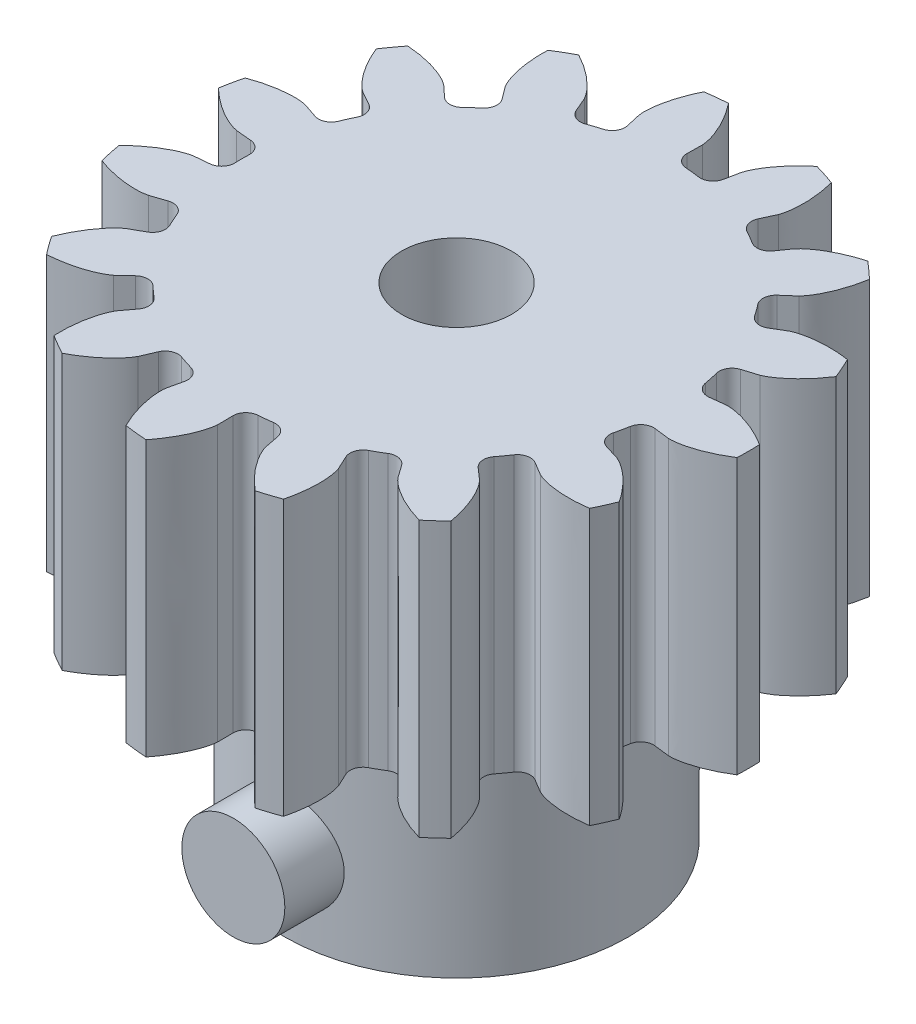
from build123d import *

# Parameters (mm, degrees)
BOSS_EXTRUDE1_DEPTH      = 4
BOSS_EXTRUDE1_DEPTH_BACK = 4
SKETCH2_R                = 5
BOSS_EXTRUDE2_DEPTH      = 6
CUT_EXTRUDE1_REACH       = 20.444
SKETCH3_R                = 1.6
BOSS_EXTRUDE3_START      = 4.5
SKETCH6_R                = 1.5
BOSS_EXTRUDE3_DEPTH      = 2


with BuildPart() as part:
    # Sketch1 → Boss-Extrude1 (new, two sides: drawn at the far end of the back side and taken through both)
    with BuildSketch(Plane(origin=(0, 0, 8), x_dir=(1, 0, 0), z_dir=(0, -1, 0)).offset(-BOSS_EXTRUDE1_DEPTH_BACK)):
        with BuildLine():
            Line((6.567109026, -8.789353559), (7.013376588, -8.842263002))
            add(Edge.make_bspline(
                [(7.013376588, -8.842263002), (7.13650623, -8.846158953), (7.26014648, -8.826739675), (7.380662944, -8.801207947), (7.5493573, -8.765469607), (7.714728417, -8.712040157), (7.874555163, -8.647306658), (8.089914841, -8.560081048), (8.297207677, -8.451055972), (8.493631405, -8.3269358)],
                knots=[0, 0, 0, 0, 0.000369574, 0.000369574, 0.000369574, 0.000886684, 0.000886684, 0.000886684, 0.001584079, 0.001584079, 0.001584079, 0.001584079], degree=3))
            ThreePointArc((8.493631405, -8.3269358), (8.499921204, -8), (8.493631405, -7.6730642))
            add(Edge.make_bspline(
                [(8.493631405, -7.6730642), (8.306513905, -7.554824634), (8.109584884, -7.450333654), (7.905230151, -7.36528839), (7.765919668, -7.307312258), (7.622450842, -7.257991784), (7.476161462, -7.221004491), (7.40107364, -7.20201955), (7.325048593, -7.186231596), (7.248436403, -7.174865806), (7.170725894, -7.163337076), (7.091898317, -7.155252488), (7.013376588, -7.157736998)],
                knots=[0, 0, 0, 0, 0.000664035, 0.000664035, 0.000664035, 0.001116085, 0.001116085, 0.001116085, 0.001347695, 0.001347695, 0.001347695, 0.001582954, 0.001582954, 0.001582954, 0.001582954], degree=3))
            Line((7.013376588, -7.157736998), (6.567109026, -7.210646441))
            ThreePointArc((6.567109026, -7.210646441), (6.299401561, -7.139849418), (6.153266145, -6.90463899))
            ThreePointArc((6.153266145, -6.90463899), (6.113422505, -6.700551932), (6.066811797, -6.49790326))
            ThreePointArc((6.066811797, -6.49790326), (6.104644442, -6.223589213), (6.320411637, -6.050026478))
            Line((6.320411637, -6.050026478), (6.749617551, -5.91684829))
            add(Edge.make_bspline(
                [(6.749617551, -5.91684829), (6.863686702, -5.870326081), (6.968739159, -5.802296667), (7.068451738, -5.729953811), (7.208025608, -5.628691037), (7.337367925, -5.512618312), (7.457047437, -5.388473925), (7.618310441, -5.221194693), (7.763337377, -5.037281737), (7.892295159, -4.84399959)],
                knots=[0, 0, 0, 0, 0.000369574, 0.000369574, 0.000369574, 0.000886684, 0.000886684, 0.000886684, 0.001584079, 0.001584079, 0.001584079, 0.001584079], degree=3))
            ThreePointArc((7.892295159, -4.84399959), (7.765064406, -4.542770583), (7.626341619, -4.246658159))
            add(Edge.make_bspline(
                [(7.626341619, -4.246658159), (7.407308913, -4.214748485), (7.18490499, -4.199389474), (6.963626627, -4.204815317), (6.81277915, -4.208514164), (6.661653412, -4.221811698), (6.512967325, -4.247523375), (6.436649316, -4.260720737), (6.360775441, -4.277219896), (6.286163839, -4.297997716), (6.2104826, -4.319073408), (6.135181726, -4.343749833), (6.064459099, -4.37795721)],
                knots=[0, 0, 0, 0, 0.000664035, 0.000664035, 0.000664035, 0.001116085, 0.001116085, 0.001116085, 0.001347695, 0.001347695, 0.001347695, 0.001582954, 0.001582954, 0.001582954, 0.001582954], degree=3))
            Line((6.064459099, -4.37795721), (5.678293604, -4.607805762))
            ThreePointArc((5.678293604, -4.607805762), (5.404934922, -4.652015898), (5.175764877, -4.496579109))
            ThreePointArc((5.175764877, -4.496579109), (5.056356215, -4.326342173), (4.931350574, -4.160171681))
            ThreePointArc((4.931350574, -4.160171681), (4.854338841, -3.894185407), (4.980857657, -3.647867535))
            Line((4.980857657, -3.647867535), (5.318788321, -3.351629433))
            add(Edge.make_bspline(
                [(5.318788321, -3.351629433), (5.404073389, -3.262733177), (5.472373528, -3.157856531), (5.534041011, -3.051211284), (5.620360805, -2.90193333), (5.691309861, -2.743287359), (5.750148465, -2.581197774), (5.829430956, -2.362789019), (5.887115516, -2.135788405), (5.926309381, -1.906764522)],
                knots=[0, 0, 0, 0, 0.000369574, 0.000369574, 0.000369574, 0.000886684, 0.000886684, 0.000886684, 0.001584079, 0.001584079, 0.001584079, 0.001584079], degree=3))
            ThreePointArc((5.926309381, -1.906764522), (5.687557429, -1.68332754), (5.440388084, -1.469239021))
            add(Edge.make_bspline(
                [(5.440388084, -1.469239021), (5.227312916, -1.529176712), (5.01788975, -1.605605381), (4.817948796, -1.700564154), (4.681647225, -1.765298415), (4.548995588, -1.838914692), (4.42362197, -1.922879558), (4.35926985, -1.965977279), (4.296666428, -2.011910696), (4.236956439, -2.061239451), (4.176390443, -2.111275387), (4.117636479, -2.164446048), (4.066941537, -2.224461526)],
                knots=[0, 0, 0, 0, 0.000664035, 0.000664035, 0.000664035, 0.001116085, 0.001116085, 0.001116085, 0.001347695, 0.001347695, 0.001347695, 0.001582954, 0.001582954, 0.001582954, 0.001582954], degree=3))
            Line((4.066941537, -2.224461526), (3.807649632, -2.591506283))
            ThreePointArc((3.807649632, -2.591506283), (3.575905932, -2.743079246), (3.30332684, -2.694292527))
            ThreePointArc((3.30332684, -2.694292527), (3.125, -2.587341226), (2.943214036, -2.486381303))
            ThreePointArc((2.943214036, -2.486381303), (2.764673953, -2.274714244), (2.780068139, -1.998231832))
            Line((2.780068139, -1.998231832), (2.96829227, -1.590156076))
            add(Edge.make_bspline(
                [(2.96829227, -1.590156076), (3.010046692, -1.474256743), (3.029784799, -1.35066699), (3.042744319, -1.228159284), (3.06088456, -1.056677664), (3.061172619, -0.882889777), (3.048996584, -0.710881757), (3.0325899, -0.479108337), (2.992957899, -0.248270532), (2.935610871, -0.023105224)],
                knots=[0, 0, 0, 0, 0.000369574, 0.000369574, 0.000369574, 0.000886684, 0.000886684, 0.000886684, 0.001584079, 0.001584079, 0.001584079, 0.001584079], degree=3))
            ThreePointArc((2.935610871, -0.023105224), (2.626620103, 0.083905449), (2.313742025, 0.178952213))
            add(Edge.make_bspline(
                [(2.313742025, 0.178952213), (2.143467028, 0.03753093), (1.983235787, -0.117470209), (1.839203848, -0.285542678), (1.741015964, -0.400119211), (1.6497751, -0.521325308), (1.569392189, -0.649025074), (1.528133024, -0.714571167), (1.489624757, -0.781996537), (1.455140779, -0.851346838), (1.420162438, -0.92169135), (1.388114476, -0.994162555), (1.366212837, -1.069608913)],
                knots=[0, 0, 0, 0, 0.000664035, 0.000664035, 0.000664035, 0.001116085, 0.001116085, 0.001116085, 0.001347695, 0.001347695, 0.001347695, 0.001582954, 0.001582954, 0.001582954, 0.001582954], degree=3))
            Line((1.366212837, -1.069608913), (1.278628447, -1.510384503))
            ThreePointArc((1.278628447, -1.510384503), (1.128570321, -1.743111949), (0.859713583, -1.809410969))
            ThreePointArc((0.859713583, -1.809410969), (0.653302895, -1.784238154), (0.446169054, -1.765945687))
            ThreePointArc((0.446169054, -1.765945687), (0.196971823, -1.645197001), (0.098579583, -1.38635637))
            Line((0.098579583, -1.38635637), (0.10455152, -0.937002965))
            add(Edge.make_bspline(
                [(0.10455152, -0.937002965), (0.095555577, -0.814140602), (0.063318754, -0.693207534), (0.025329491, -0.576020064), (-0.027846432, -0.411985508), (-0.09826918, -0.253105209), (-0.179354506, -0.100920504), (-0.2886135, 0.104141852), (-0.418709328, 0.298902893), (-0.562681427, 0.4812765)],
                knots=[0, 0, 0, 0, 0.000369574, 0.000369574, 0.000369574, 0.000886684, 0.000886684, 0.000886684, 0.001584079, 0.001584079, 0.001584079, 0.001584079], degree=3))
            ThreePointArc((-0.562681427, 0.4812765), (-0.888483701, 0.453357746), (-1.21297105, 0.412928307))
            add(Edge.make_bspline(
                [(-1.21297105, 0.412928307), (-1.311003782, 0.214476455), (-1.394337662, 0.007703951), (-1.457556153, -0.204420956), (-1.500652775, -0.349028438), (-1.53470649, -0.49686672), (-1.556199759, -0.646220937), (-1.567231884, -0.722881886), (-1.574986569, -0.80014075), (-1.57828194, -0.8775213), (-1.581624555, -0.956011182), (-1.58142513, -1.035252003), (-1.570746474, -1.11308388)],
                knots=[0, 0, 0, 0, 0.000664035, 0.000664035, 0.000664035, 0.001116085, 0.001116085, 0.001116085, 0.001347695, 0.001347695, 0.001347695, 0.001582954, 0.001582954, 0.001582954, 0.001582954], degree=3))
            Line((-1.570746474, -1.11308388), (-1.471479212, -1.551376199))
            ThreePointArc((-1.471479212, -1.551376199), (-1.513905352, -1.825017438), (-1.732551962, -1.994938493))
            ThreePointArc((-1.732551962, -1.994938493), (-1.931356215, -2.055896773), (-2.128022611, -2.123434697))
            ThreePointArc((-2.128022611, -2.123434697), (-2.404788525, -2.114482928), (-2.599954278, -1.918039975))
            Line((-2.599954278, -1.918039975), (-2.777267138, -1.505106207))
            add(Edge.make_bspline(
                [(-2.777267138, -1.505106207), (-2.835457966, -1.396524834), (-2.914095679, -1.299158875), (-2.996465036, -1.20755442), (-3.111762524, -1.079329993), (-3.240719344, -0.962829129), (-3.376693572, -0.856781856), (-3.559913004, -0.713887709), (-3.757977909, -0.588879385), (-3.963680994, -0.480831533)],
                knots=[0, 0, 0, 0, 0.000369574, 0.000369574, 0.000369574, 0.000886684, 0.000886684, 0.000886684, 0.001584079, 0.001584079, 0.001584079, 0.001584079], degree=3))
            ThreePointArc((-3.963680994, -0.480831533), (-4.249960602, -0.638852307), (-4.529950411, -0.807767333))
            add(Edge.make_bspline(
                [(-4.529950411, -0.807767333), (-4.538790128, -1.028935625), (-4.530817461, -1.251726649), (-4.502291454, -1.471225671), (-4.482845015, -1.620860155), (-4.453823386, -1.76976804), (-4.412710631, -1.914952006), (-4.391608162, -1.989472438), (-4.367268408, -2.063206036), (-4.338805374, -2.135237034), (-4.309934294, -2.208300674), (-4.277521964, -2.280609652), (-4.236109451, -2.347369209)],
                knots=[0, 0, 0, 0, 0.000664035, 0.000664035, 0.000664035, 0.001116085, 0.001116085, 0.001116085, 0.001347695, 0.001347695, 0.001347695, 0.001582954, 0.001582954, 0.001582954, 0.001582954], degree=3))
            Line((-4.236109451, -2.347369209), (-3.967154748, -2.707393534))
            ThreePointArc((-3.967154748, -2.707393534), (-3.894613036, -2.974633511), (-4.025243534, -3.218795707))
            ThreePointArc((-4.025243534, -3.218795707), (-4.18206629, -3.355344841), (-4.334259835, -3.497035234))
            ThreePointArc((-4.334259835, -3.497035234), (-4.59073909, -3.601428225), (-4.848932425, -3.501349721))
            Line((-4.848932425, -3.501349721), (-5.178871077, -3.19623559))
            add(Edge.make_bspline(
                [(-5.178871077, -3.19623559), (-5.276195067, -3.120709912), (-5.387636496, -3.063746522), (-5.500143536, -3.013564324), (-5.657626606, -2.943321194), (-5.822819693, -2.889343824), (-5.990171643, -2.84777052), (-6.215671209, -2.791752278), (-6.447457969, -2.758111746), (-6.679324109, -2.743072103)],
                knots=[0, 0, 0, 0, 0.000369574, 0.000369574, 0.000369574, 0.000886684, 0.000886684, 0.000886684, 0.001584079, 0.001584079, 0.001584079, 0.001584079], degree=3))
            ThreePointArc((-6.679324109, -2.743072103), (-6.876580705, -3.003871671), (-7.063660193, -3.27206534))
            add(Edge.make_bspline(
                [(-7.063660193, -3.27206534), (-6.981778428, -3.477708065), (-6.883877761, -3.677995018), (-6.768539661, -3.86691478), (-6.689912627, -3.995703104), (-6.602833756, -4.119933065), (-6.506223747, -4.235843155), (-6.456635492, -4.295337809), (-6.404409863, -4.352796933), (-6.349109942, -4.407023566), (-6.293017238, -4.462027595), (-6.233996391, -4.514901852), (-6.169010619, -4.559045755)],
                knots=[0, 0, 0, 0, 0.000664035, 0.000664035, 0.000664035, 0.001116085, 0.001116085, 0.001116085, 0.001347695, 0.001347695, 0.001347695, 0.001582954, 0.001582954, 0.001582954, 0.001582954], degree=3))
            Line((-6.169010619, -4.559045755), (-5.776873187, -4.778550608))
            ThreePointArc((-5.776873187, -4.778550608), (-5.601906744, -4.993181103), (-5.62193393, -5.269366579))
            ThreePointArc((-5.62193393, -5.269366579), (-5.70965911, -5.457895981), (-5.791064157, -5.649239287))
            ThreePointArc((-5.791064157, -5.649239287), (-5.982909161, -5.848926542), (-6.259486104, -5.862516969))
            Line((-6.259486104, -5.862516969), (-6.685001158, -5.71797948))
            add(Edge.make_bspline(
                [(-6.685001158, -5.71797948), (-6.804630108, -5.688568573), (-6.929606017, -5.68185724), (-7.052797252, -5.681774257), (-7.225235649, -5.681658099), (-7.398101619, -5.6995374), (-7.567894618, -5.729626467), (-7.796683394, -5.770170193), (-8.022113973, -5.833714206), (-8.240051405, -5.914283265)],
                knots=[0, 0, 0, 0, 0.000369574, 0.000369574, 0.000369574, 0.000886684, 0.000886684, 0.000886684, 0.001584079, 0.001584079, 0.001584079, 0.001584079], degree=3))
            ThreePointArc((-8.240051405, -5.914283265), (-8.314177532, -6.232767011), (-8.375998955, -6.553866202))
            add(Edge.make_bspline(
                [(-8.375998955, -6.553866202), (-8.217553809, -6.708425865), (-8.046653057, -6.851577312), (-7.86444587, -6.977251872), (-7.74023357, -7.062925364), (-7.610154186, -7.140996913), (-7.47475167, -7.207591218), (-7.405251888, -7.241772929), (-7.334170672, -7.273022374), (-7.261595722, -7.300068364), (-7.187980332, -7.327502086), (-7.112556207, -7.351799182), (-7.035233808, -7.36569455)],
                knots=[0, 0, 0, 0, 0.000664035, 0.000664035, 0.000664035, 0.001116085, 0.001116085, 0.001116085, 0.001347695, 0.001347695, 0.001347695, 0.001582954, 0.001582954, 0.001582954, 0.001582954], degree=3))
            Line((-7.035233808, -7.36569455), (-6.587717771, -7.406725549))
            ThreePointArc((-6.587717771, -7.406725549), (-6.340579885, -7.531634999), (-6.246540877, -7.792088776))
            ThreePointArc((-6.246540877, -7.792088776), (-6.25, -8), (-6.246540877, -8.207911224))
            ThreePointArc((-6.246540877, -8.207911224), (-6.340579885, -8.468365001), (-6.587717771, -8.593274451))
            Line((-6.587717771, -8.593274451), (-7.035233808, -8.63430545))
            add(Edge.make_bspline(
                [(-7.035233808, -8.63430545), (-7.156482786, -8.656094727), (-7.273383704, -8.700795901), (-7.38595825, -8.750826481), (-7.54353581, -8.820857381), (-7.694184564, -8.907501859), (-7.837059861, -9.004050624), (-8.029578189, -9.134145939), (-8.209673592, -9.283887161), (-8.375998955, -9.446133798)],
                knots=[0, 0, 0, 0, 0.000369574, 0.000369574, 0.000369574, 0.000886684, 0.000886684, 0.000886684, 0.001584079, 0.001584079, 0.001584079, 0.001584079], degree=3))
            ThreePointArc((-8.375998955, -9.446133798), (-8.314177532, -9.767232989), (-8.240051405, -10.085716735))
            add(Edge.make_bspline(
                [(-8.240051405, -10.085716735), (-8.032439483, -10.162468567), (-7.818088938, -10.223732323), (-7.600517942, -10.264431406), (-7.452197811, -10.292176342), (-7.30160982, -10.310590199), (-7.150827123, -10.316353959), (-7.073432959, -10.319312397), (-6.995786742, -10.31894885), (-6.918485631, -10.3141377), (-6.840076326, -10.309257577), (-6.76129044, -10.300776323), (-6.685001158, -10.28202052)],
                knots=[0, 0, 0, 0, 0.000664035, 0.000664035, 0.000664035, 0.001116085, 0.001116085, 0.001116085, 0.001347695, 0.001347695, 0.001347695, 0.001582954, 0.001582954, 0.001582954, 0.001582954], degree=3))
            Line((-6.685001158, -10.28202052), (-6.259486104, -10.137483031))
            ThreePointArc((-6.259486104, -10.137483031), (-5.982909161, -10.151073458), (-5.791064157, -10.350760713))
            ThreePointArc((-5.791064157, -10.350760713), (-5.70965911, -10.542104019), (-5.62193393, -10.730633421))
            ThreePointArc((-5.62193393, -10.730633421), (-5.601906744, -11.006818897), (-5.776873187, -11.221449392))
            Line((-5.776873187, -11.221449392), (-6.169010619, -11.440954245))
            add(Edge.make_bspline(
                [(-6.169010619, -11.440954245), (-6.270914575, -11.510176142), (-6.359527273, -11.598560583), (-6.442019967, -11.690053985), (-6.557490098, -11.818122964), (-6.659873099, -11.958551002), (-6.751126257, -12.104865306), (-6.87408597, -12.302017549), (-6.977706065, -12.512064361), (-7.063660193, -12.72793466)],
                knots=[0, 0, 0, 0, 0.000369574, 0.000369574, 0.000369574, 0.000886684, 0.000886684, 0.000886684, 0.001584079, 0.001584079, 0.001584079, 0.001584079], degree=3))
            ThreePointArc((-7.063660193, -12.72793466), (-6.876580705, -12.996128329), (-6.679324109, -13.256927897))
            add(Edge.make_bspline(
                [(-6.679324109, -13.256927897), (-6.458443398, -13.242600808), (-6.237706217, -13.211383812), (-6.022391413, -13.160070178), (-5.875609349, -13.125089206), (-5.730550784, -13.080661448), (-5.590459603, -13.024598056), (-5.518553211, -12.995821682), (-5.44776773, -12.963908004), (-5.379106522, -12.928071605), (-5.309460983, -12.891721453), (-5.240936131, -12.851928335), (-5.178871077, -12.80376441)],
                knots=[0, 0, 0, 0, 0.000664035, 0.000664035, 0.000664035, 0.001116085, 0.001116085, 0.001116085, 0.001347695, 0.001347695, 0.001347695, 0.001582954, 0.001582954, 0.001582954, 0.001582954], degree=3))
            Line((-5.178871077, -12.80376441), (-4.848932425, -12.498650279))
            ThreePointArc((-4.848932425, -12.498650279), (-4.59073909, -12.398571775), (-4.334259835, -12.502964766))
            ThreePointArc((-4.334259835, -12.502964766), (-4.18206629, -12.644655159), (-4.025243534, -12.781204293))
            ThreePointArc((-4.025243534, -12.781204293), (-3.894613036, -13.025366489), (-3.967154748, -13.292606466))
            Line((-3.967154748, -13.292606466), (-4.236109451, -13.652630791))
            add(Edge.make_bspline(
                [(-4.236109451, -13.652630791), (-4.301048265, -13.757316213), (-4.346050801, -13.87410145), (-4.384197908, -13.991237633), (-4.437594776, -14.1552004), (-4.474009073, -14.325130714), (-4.497861591, -14.495911486), (-4.530001837, -14.726031242), (-4.539229769, -14.960064643), (-4.529950411, -15.192232667)],
                knots=[0, 0, 0, 0, 0.000369574, 0.000369574, 0.000369574, 0.000886684, 0.000886684, 0.000886684, 0.001584079, 0.001584079, 0.001584079, 0.001584079], degree=3))
            ThreePointArc((-4.529950411, -15.192232667), (-4.249960602, -15.361147693), (-3.963680994, -15.519168467))
            add(Edge.make_bspline(
                [(-3.963680994, -15.519168467), (-3.767723776, -15.416239741), (-3.578767423, -15.297939697), (-3.402938697, -15.163485939), (-3.283074653, -15.071827587), (-3.168627456, -14.972240176), (-3.06345083, -14.864043503), (-3.009465478, -14.808508013), (-2.957780186, -14.750562368), (-2.909631028, -14.689897159), (-2.860791601, -14.62836225), (-2.814376353, -14.56413786), (-2.777267138, -14.494893793)],
                knots=[0, 0, 0, 0, 0.000664035, 0.000664035, 0.000664035, 0.001116085, 0.001116085, 0.001116085, 0.001347695, 0.001347695, 0.001347695, 0.001582954, 0.001582954, 0.001582954, 0.001582954], degree=3))
            Line((-2.777267138, -14.494893793), (-2.599954278, -14.081960025))
            ThreePointArc((-2.599954278, -14.081960025), (-2.404788525, -13.885517072), (-2.128022611, -13.876565303))
            ThreePointArc((-2.128022611, -13.876565303), (-1.931356215, -13.944103227), (-1.732551962, -14.005061507))
            ThreePointArc((-1.732551962, -14.005061507), (-1.513905352, -14.174982562), (-1.471479212, -14.448623801))
            Line((-1.471479212, -14.448623801), (-1.570746474, -14.88691612))
            add(Edge.make_bspline(
                [(-1.570746474, -14.88691612), (-1.587491636, -15.008964007), (-1.581102663, -15.13395681), (-1.568308202, -15.256481865), (-1.550399002, -15.427987769), (-1.514548232, -15.598037864), (-1.466875795, -15.763755556), (-1.402639232, -15.98705303), (-1.315879408, -16.204606518), (-1.21297105, -16.412928307)],
                knots=[0, 0, 0, 0, 0.000369574, 0.000369574, 0.000369574, 0.000886684, 0.000886684, 0.000886684, 0.001584079, 0.001584079, 0.001584079, 0.001584079], degree=3))
            ThreePointArc((-1.21297105, -16.412928307), (-0.888483701, -16.453357746), (-0.562681427, -16.4812765))
            add(Edge.make_bspline(
                [(-0.562681427, -16.4812765), (-0.425530485, -16.307543449), (-0.30102723, -16.122615508), (-0.195086966, -15.928269903), (-0.122866523, -15.795782733), (-0.058819656, -15.658255237), (-0.006743578, -15.51663347), (0.019986176, -15.443941454), (0.043634423, -15.369983172), (0.062946104, -15.294978719), (0.082534638, -15.218898997), (0.098814664, -15.141348316), (0.10455152, -15.062997035)],
                knots=[0, 0, 0, 0, 0.000664035, 0.000664035, 0.000664035, 0.001116085, 0.001116085, 0.001116085, 0.001347695, 0.001347695, 0.001347695, 0.001582954, 0.001582954, 0.001582954, 0.001582954], degree=3))
            Line((0.10455152, -15.062997035), (0.098579583, -14.61364363))
            ThreePointArc((0.098579583, -14.61364363), (0.196971823, -14.354802999), (0.446169054, -14.234054313))
            ThreePointArc((0.446169054, -14.234054313), (0.653302895, -14.215761846), (0.859713583, -14.190589031))
            ThreePointArc((0.859713583, -14.190589031), (1.128570321, -14.256888051), (1.278628447, -14.489615497))
            Line((1.278628447, -14.489615497), (1.366212837, -14.930391087))
            add(Edge.make_bspline(
                [(1.366212837, -14.930391087), (1.400556719, -15.048698251), (1.457232489, -15.160286229), (1.51875624, -15.267014459), (1.604874844, -15.416408571), (1.706791757, -15.557175242), (1.817746153, -15.689175759), (1.967252438, -15.867040788), (2.134998457, -16.030497389), (2.313742025, -16.178952213)],
                knots=[0, 0, 0, 0, 0.000369574, 0.000369574, 0.000369574, 0.000886684, 0.000886684, 0.000886684, 0.001584079, 0.001584079, 0.001584079, 0.001584079], degree=3))
            ThreePointArc((2.313742025, -16.178952213), (2.626620103, -16.083905449), (2.935610871, -15.976894776))
            add(Edge.make_bspline(
                [(2.935610871, -15.976894776), (2.990240893, -15.762397423), (3.028763307, -15.542817307), (3.046497074, -15.322183974), (3.058586345, -15.171776221), (3.061158598, -15.020088395), (3.051129699, -14.869529224), (3.045982039, -14.792249792), (3.037504244, -14.715066931), (3.024639283, -14.638692185), (3.011589889, -14.561222526), (2.994919729, -14.48375477), (2.96829227, -14.409843924)],
                knots=[0, 0, 0, 0, 0.000664035, 0.000664035, 0.000664035, 0.001116085, 0.001116085, 0.001116085, 0.001347695, 0.001347695, 0.001347695, 0.001582954, 0.001582954, 0.001582954, 0.001582954], degree=3))
            Line((2.96829227, -14.409843924), (2.780068139, -14.001768168))
            ThreePointArc((2.780068139, -14.001768168), (2.764673953, -13.725285756), (2.943214036, -13.513618697))
            ThreePointArc((2.943214036, -13.513618697), (3.125, -13.412658774), (3.30332684, -13.305707473))
            ThreePointArc((3.30332684, -13.305707473), (3.575905932, -13.256920754), (3.807649632, -13.408493717))
            Line((3.807649632, -13.408493717), (4.066941537, -13.775538474))
            add(Edge.make_bspline(
                [(4.066941537, -13.775538474), (4.146436093, -13.869648531), (4.243598905, -13.948537109), (4.343213931, -14.021014235), (4.48265125, -14.122464955), (4.633011946, -14.209608365), (4.788063278, -14.285067619), (4.99698829, -14.386745724), (5.216715693, -14.467842307), (5.440388084, -14.530760979)],
                knots=[0, 0, 0, 0, 0.000369574, 0.000369574, 0.000369574, 0.000886684, 0.000886684, 0.000886684, 0.001584079, 0.001584079, 0.001584079, 0.001584079], degree=3))
            ThreePointArc((5.440388084, -14.530760979), (5.687557429, -14.31667246), (5.926309381, -14.093235478))
            add(Edge.make_bspline(
                [(5.926309381, -14.093235478), (5.888972455, -13.875062364), (5.834853152, -13.658797468), (5.761314093, -13.450025917), (5.711181847, -13.307704447), (5.65183472, -13.168084493), (5.581434934, -13.034620967), (5.545299935, -12.966116436), (5.506161986, -12.899054613), (5.463344851, -12.834515462), (5.419913888, -12.769051074), (5.373175964, -12.705061122), (5.318788321, -12.648370567)],
                knots=[0, 0, 0, 0, 0.000664035, 0.000664035, 0.000664035, 0.001116085, 0.001116085, 0.001116085, 0.001347695, 0.001347695, 0.001347695, 0.001582954, 0.001582954, 0.001582954, 0.001582954], degree=3))
            Line((5.318788321, -12.648370567), (4.980857657, -12.352132465))
            ThreePointArc((4.980857657, -12.352132465), (4.854338841, -12.105814593), (4.931350574, -11.839828319))
            ThreePointArc((4.931350574, -11.839828319), (5.056356215, -11.673657827), (5.175764877, -11.503420891))
            ThreePointArc((5.175764877, -11.503420891), (5.404934922, -11.347984102), (5.678293604, -11.392194238))
            Line((5.678293604, -11.392194238), (6.064459099, -11.62204279))
            add(Edge.make_bspline(
                [(6.064459099, -11.62204279), (6.175358998, -11.675683256), (6.296208519, -11.708231882), (6.416690476, -11.73392595), (6.585336531, -11.769891528), (6.758142279, -11.788343789), (6.930480763, -11.79421419), (7.16269947, -11.802124303), (7.396415393, -11.786838532), (7.626341619, -11.753341841)],
                knots=[0, 0, 0, 0, 0.000369574, 0.000369574, 0.000369574, 0.000886684, 0.000886684, 0.000886684, 0.001584079, 0.001584079, 0.001584079, 0.001584079], degree=3))
            ThreePointArc((7.626341619, -11.753341841), (7.765064406, -11.457229417), (7.892295159, -11.15600041))
            add(Edge.make_bspline(
                [(7.892295159, -11.15600041), (7.76944718, -10.971875648), (7.632043879, -10.796320139), (7.479947566, -10.635508866), (7.376262124, -10.525882356), (7.265257274, -10.422471832), (7.146659362, -10.329181007), (7.085785095, -10.281296432), (7.022754299, -10.235951246), (6.957388463, -10.194407095), (6.891085538, -10.152267365), (6.822361261, -10.112819662), (6.749617551, -10.08315171)],
                knots=[0, 0, 0, 0, 0.000664035, 0.000664035, 0.000664035, 0.001116085, 0.001116085, 0.001116085, 0.001347695, 0.001347695, 0.001347695, 0.001582954, 0.001582954, 0.001582954, 0.001582954], degree=3))
            Line((6.749617551, -10.08315171), (6.320411637, -9.949973522))
            ThreePointArc((6.320411637, -9.949973522), (6.104644442, -9.776410787), (6.066811797, -9.50209674))
            ThreePointArc((6.066811797, -9.50209674), (6.113422505, -9.299448068), (6.153266145, -9.09536101))
            ThreePointArc((6.153266145, -9.09536101), (6.299401561, -8.860150582), (6.567109026, -8.789353559))
        make_face()
    extrude(amount=BOSS_EXTRUDE1_DEPTH + BOSS_EXTRUDE1_DEPTH_BACK)

    # Sketch2 → Boss-Extrude2 (add)
    with BuildSketch(Plane(origin=(0, -4, 0), x_dir=(-1, 0, 0), z_dir=(0, -1, 0))):
        Circle(SKETCH2_R)
    extrude(amount=BOSS_EXTRUDE2_DEPTH)

    # Sketch3 → Cut-Extrude1 (cut, up to next)
    with BuildSketch(Plane(origin=(0, -10, 0), x_dir=(-1, 0, 0), z_dir=(0, -1, 0)), mode=Mode.PRIVATE) as cut_extrude1_sk1:
        Circle(SKETCH3_R)
    cut_extrude1_tool1 = extrude(cut_extrude1_sk1.sketch, amount=-CUT_EXTRUDE1_REACH, mode=Mode.PRIVATE) & part.part
    add(cut_extrude1_tool1.solids().sort_by_distance((0, -10, 0))[0], mode=Mode.SUBTRACT)

    # Sketch6 → Boss-Extrude3 (add)
    with BuildSketch(Plane.XY.offset(BOSS_EXTRUDE3_START)):
        with Locations((0, -7.75)):
            Circle(SKETCH6_R)
    extrude(amount=BOSS_EXTRUDE3_DEPTH)


solid = part.part
